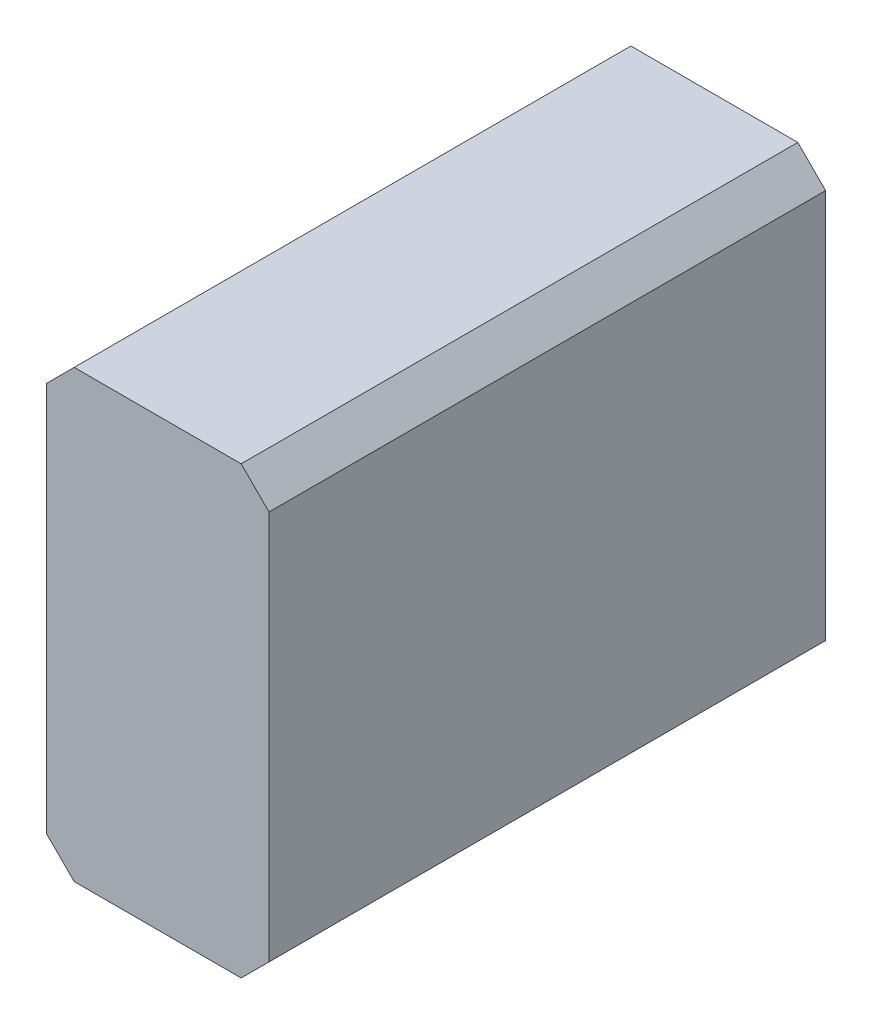
from build123d import *

# Parameters (mm, degrees)
SKETCH1_W           = 4
SKETCH1_H           = 8
BOSS_EXTRUDE1_DEPTH = 10
CHAMFER1_SIZE       = 0.5


with BuildPart() as part:
    # Sketch1 → Boss-Extrude1 (new body)
    with BuildSketch(Plane.XY):
        Rectangle(SKETCH1_W, SKETCH1_H)
    extrude(amount=BOSS_EXTRUDE1_DEPTH)

    # Chamfer1
    chamfer1_edges = [part.edges().sort_by_distance(p)[0] for p in [
        (2, -4, 5),
        (-2, -4, 5),
        (-2, 4, 5),
        (2, 4, 5),
    ]]
    chamfer(chamfer1_edges, length=CHAMFER1_SIZE)


solid = part.part
